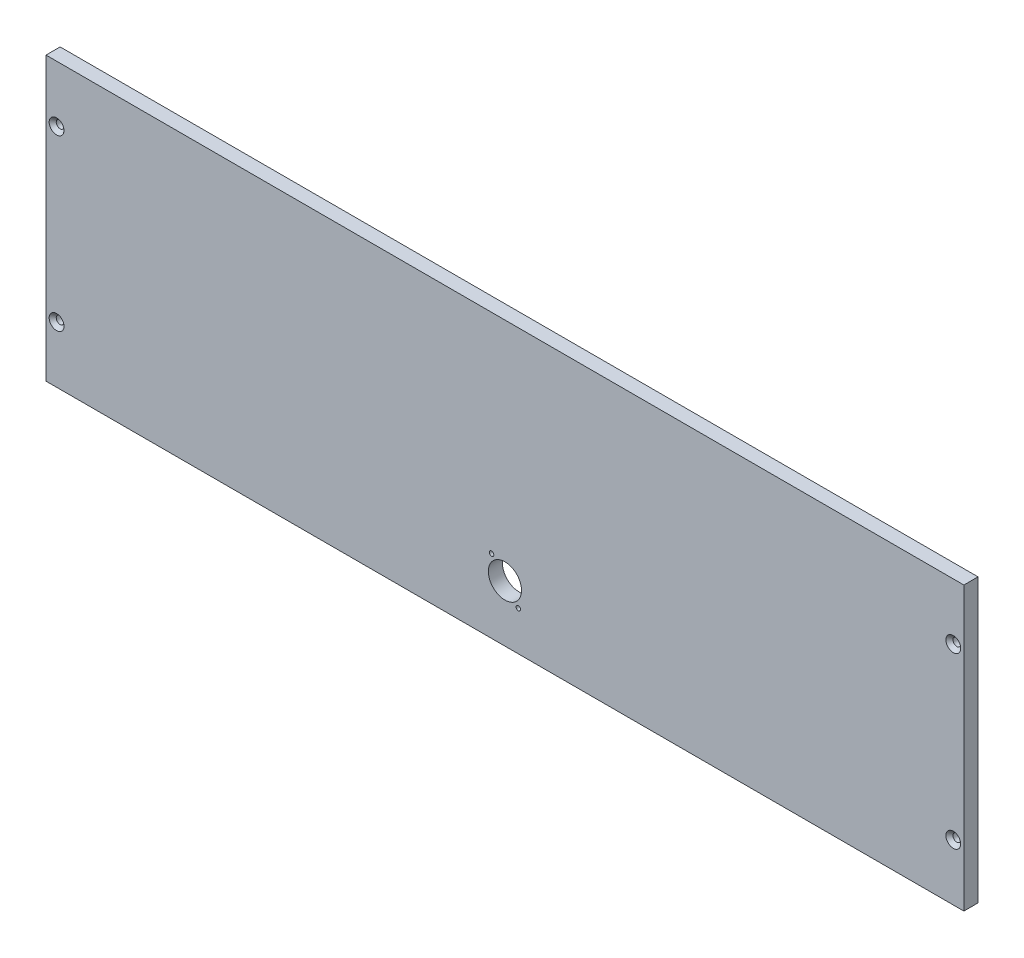
from build123d import *

# Parameters (mm, degrees)
ESQUISSE1_W             = 650
ESQUISSE1_H             = 200
BOSS_EXTRU_1_DEPTH      = 10
ESQUISSE2_R             = 2.75
ENL_V_MAT_EXTRU_1_DEPTH = 10
CHANFREIN1_SIZE         = 2.5
ESQUISSE3_R             = 11.75
ESQUISSE3_R_2           = 1.6
ENL_V_MAT_EXTRU_2_DEPTH = 10


with BuildPart() as part:
    # Esquisse1 → Boss.-Extru.1 (new body)
    with BuildSketch(Plane.XY):
        with Locations((325, 100)):
            Rectangle(ESQUISSE1_W, ESQUISSE1_H)
    extrude(amount=BOSS_EXTRU_1_DEPTH)

    # Esquisse2 → Enlèv. mat.-Extru.1 (cut)
    with BuildSketch(Plane.XY.offset(10)):
        with Locations((7.5, 160)):
            Circle(ESQUISSE2_R)
        with Locations((642.5, 160)):
            Circle(ESQUISSE2_R)
        with Locations((7.5, 40)):
            Circle(ESQUISSE2_R)
        with Locations((642.5, 40)):
            Circle(ESQUISSE2_R)
    extrude(amount=-ENL_V_MAT_EXTRU_1_DEPTH, mode=Mode.SUBTRACT)

    # Chanfrein1
    chanfrein1_edges = [part.edges().sort_by_distance(p)[0] for p in [
        (4.75, 160, 10),
        (639.75, 160, 10),
        (4.75, 40, 10),
        (639.75, 40, 10),
    ]]
    chamfer(chanfrein1_edges, length=CHANFREIN1_SIZE)

    # Esquisse3 → Enlèv. mat.-Extru.2 (cut)
    with BuildSketch(Plane.XY.offset(10)):
        with Locations((325, 40)):
            Circle(ESQUISSE3_R)
        with Locations((315.499614794, 51.999404399)):
            Circle(ESQUISSE3_R_2)
        with Locations((334.500385206, 28.000595601)):
            Circle(ESQUISSE3_R_2)
    extrude(amount=-ENL_V_MAT_EXTRU_2_DEPTH, mode=Mode.SUBTRACT)


solid = part.part
